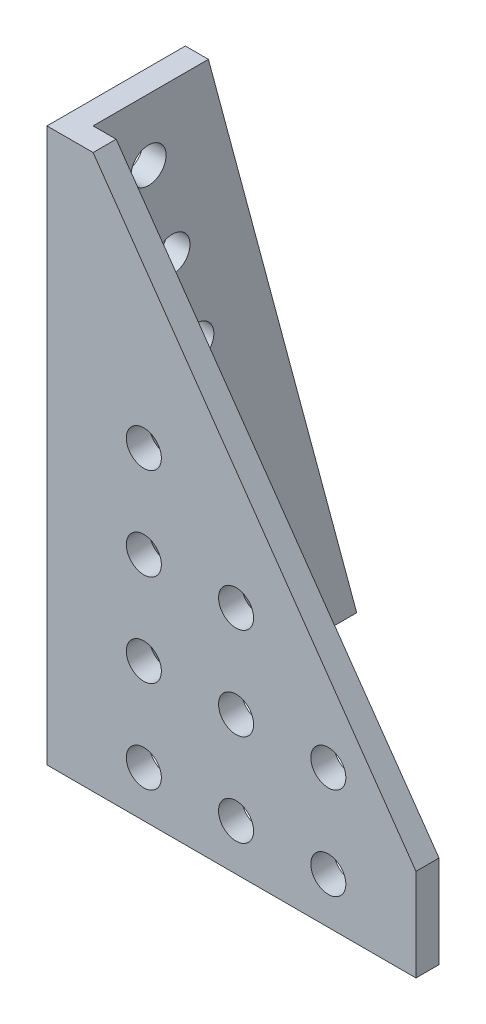
from build123d import *

# Parameters (mm, degrees)
BOSS_EXTRUDE1_DEPTH = 76.2
SKETCH2_R           = 2.413
CUT_EXTRUDE1_DEPTH  = 3.175
SKETCH4_R           = 2.413
CUT_EXTRUDE2_DEPTH  = 104.224128115


with BuildPart() as part:
    # Sketch1 → Boss-Extrude1 (new body)
    with BuildSketch(Plane(origin=(0, 0, 0), x_dir=(1, 0, 0), z_dir=(0, 1, 0))):
        Polygon((0, 50.8), (0, 0), (50.8, 0), (50.8, 3.175), (3.175, 3.175), (3.175, 50.8), align=None)
    extrude(amount=BOSS_EXTRUDE1_DEPTH)

    # Sketch2 → Cut-Extrude1 (cut)
    with BuildSketch(Plane(origin=(0, 0, -3.175), x_dir=(-1, 0, 0), z_dir=(0, 0, -1))):
        Polygon((-50.8, 12.7188211), (-6.35, 76.2), (-50.8, 76.2), align=None)
        with Locations((-13.335, 6.35)):
            Circle(SKETCH2_R)
        with Locations((-26.035, 6.35)):
            Circle(SKETCH2_R)
        with Locations((-13.335, 19.05)):
            Circle(SKETCH2_R)
        with Locations((-13.335, 31.75)):
            Circle(SKETCH2_R)
        with Locations((-13.335, 44.45)):
            Circle(SKETCH2_R)
        with Locations((-26.035, 19.05)):
            Circle(SKETCH2_R)
        with Locations((-26.035, 31.75)):
            Circle(SKETCH2_R)
        with Locations((-38.735, 19.05)):
            Circle(SKETCH2_R)
        with Locations((-38.735, 6.35)):
            Circle(SKETCH2_R)
    extrude(amount=-CUT_EXTRUDE1_DEPTH, mode=Mode.SUBTRACT)

    # Sketch4 → Cut-Extrude2 (cut, through all)
    with BuildSketch(Plane(origin=(3.175, 0, 0), x_dir=(0, 0, -1), z_dir=(1, 0, 0))):
        with Locations((27.247845098, 6.35)):
            Circle(SKETCH4_R)
        with Locations((23.960843226, 18.617257994)):
            Circle(SKETCH4_R)
        with Locations((20.673841353, 30.884515988)):
            Circle(SKETCH4_R)
        with Locations((17.38683948, 43.151773982)):
            Circle(SKETCH4_R)
        with Locations((14.099837607, 55.419031975)):
            Circle(SKETCH4_R)
        with Locations((10.812835734, 67.686289969)):
            Circle(SKETCH4_R)
        Polygon((19.05, 76.2), (50.8, 76.2), (50.8, -42.29261314), align=None)
    extrude(amount=-CUT_EXTRUDE2_DEPTH, mode=Mode.SUBTRACT)


solid = part.part
